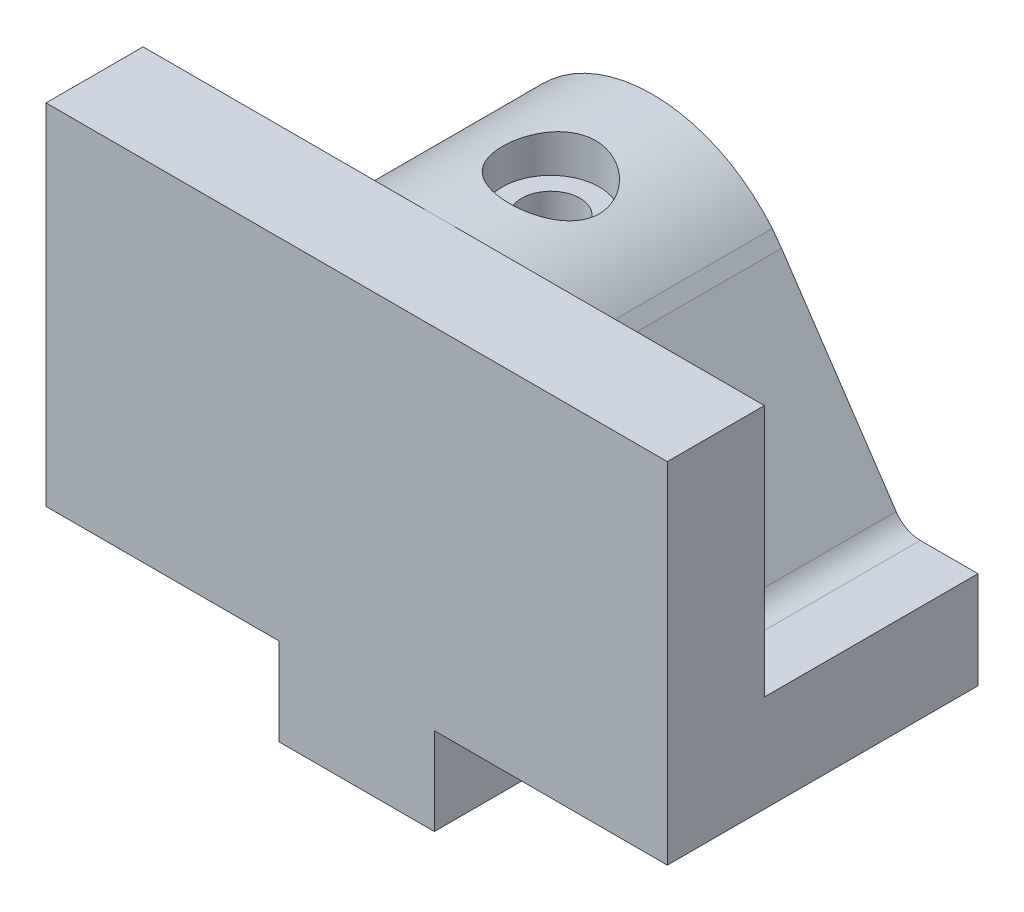
from build123d import *

# Parameters (mm, degrees)
SKETCH2_R           = 6
BOSS_EXTRUDE1_DEPTH = 11
SKETCH3_W           = 64
SKETCH3_H           = 36
BOSS_EXTRUDE2_DEPTH = 10
BOSS_EXTRUDE3_DEPTH = 32
SKETCH5_R           = 5
CUT_EXTRUDE5_DEPTH  = 4
SKETCH7_R           = 3
CUT_EXTRUDE6_DEPTH  = 10


with BuildPart() as part:
    # Sketch2 → Boss-Extrude1 (new, symmetric)
    with BuildSketch(Plane.XY):
        with BuildLine():
            Line((-30.479384134, -10), (-27.579076202, -10))
            ThreePointArc((-27.579076202, -10), (-26.167523045, -9.647171639), (-25.087993879, -8.671678457))
            Line((-25.087993879, -8.671678457), (-13.285772387, 8.915618436))
            ThreePointArc((-13.285772387, 8.915618436), (-0.796428366, 15.98016589), (12.333454196, 10.192443652))
            Line((12.333454196, 10.192443652), (13.285772387, 8.915618436))
            Line((13.285772387, 8.915618436), (25.087993879, -8.671678457))
            ThreePointArc((25.087993879, -8.671678457), (26.167523045, -9.647171639), (27.579076202, -10))
            Line((27.579076202, -10), (30.479384134, -10))
            Line((30.479384134, -10), (31.075959419, -10))
            Line((31.075959419, -10), (33.520615866, -10))
            Line((33.520615866, -10), (33.520615866, -20))
            Line((33.520615866, -20), (-30.479384134, -20))
            Line((-30.479384134, -20), (-30.479384134, -10))
        make_face()
        Circle(SKETCH2_R, mode=Mode.SUBTRACT)
    extrude(amount=BOSS_EXTRUDE1_DEPTH, both=True)

    # Sketch3 → Boss-Extrude2 (add)
    with BuildSketch(Plane.XY.offset(11)):
        with Locations((1.520615866, -2)):
            Rectangle(SKETCH3_W, SKETCH3_H)
    extrude(amount=BOSS_EXTRUDE2_DEPTH)

    # Sketch4 → Boss-Extrude3 (add)
    with BuildSketch(Plane(origin=(0, 0, -11), x_dir=(-1, 0, 0), z_dir=(0, 0, -1))):
        Polygon((-1.520615866, -20), (6.479384134, -20), (6.479384134, -29), (-9.520615866, -29), (-9.520615866, -20), align=None)
    extrude(amount=-BOSS_EXTRUDE3_DEPTH)

    # Sketch5 → Cut-Extrude5 (cut)
    with BuildSketch(Plane(origin=(0, 16, 0), x_dir=(1, 0, 0), z_dir=(0, 1, 0))):
        with Locations(Location((1.520615866, -1, 0), (0, 0, 270))):
            Circle(SKETCH5_R)
    extrude(amount=-CUT_EXTRUDE5_DEPTH, mode=Mode.SUBTRACT)

    # Sketch7 → Cut-Extrude6 (cut)
    with BuildSketch(Plane(origin=(0, 12, 0), x_dir=(1, 0, 0), z_dir=(0, 1, 0))):
        with Locations(Location((1.520615866, -1, 0), (0, 0, 270))):
            Circle(SKETCH7_R)
    extrude(amount=-CUT_EXTRUDE6_DEPTH, mode=Mode.SUBTRACT)

    # Sketch11 → Cut-Revolve1 (revolve, cut)
    with BuildSketch(Plane(origin=(1.520615866, 0, 0), x_dir=(0, 0, -1), z_dir=(1, 0, 0))):
        Polygon((3, -29), (3, -13), (3, -11.065876598), (6.35, -13), (6.35, -29), align=None)
    revolve(axis=Axis((1.520615866, -13, -3), (0, 1, 0)), mode=Mode.SUBTRACT)

    # Sketch14 → Cut-Revolve2 (revolve, cut)
    with BuildSketch(Plane(origin=(1.520615866, 0, 0), x_dir=(0, 0, -1), z_dir=(1, 0, 0)), mode=Mode.PRIVATE) as cut_revolve2_sk:
        Polygon((-16.35, -29), (-13, -29), (-13, -11.065876598), (-16.35, -13), align=None)
    revolve(cut_revolve2_sk.sketch.rotate(Axis((1.520615866, -29, 13), (0, 1, 0)), 180), axis=Axis((1.520615866, -29, 13), (0, 1, 0)), mode=Mode.SUBTRACT)


solid = part.part
